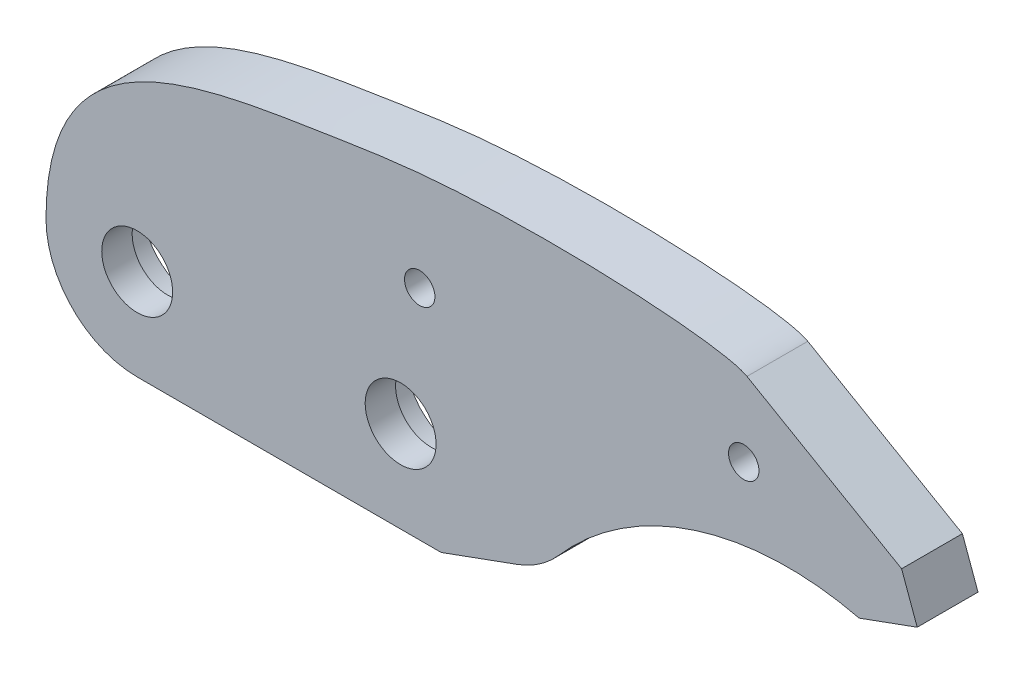
from build123d import *

# Parameters (mm, degrees)
SKETCH1_R           = 3.5
EXTRUSION1_DEPTH    = 6
SKETCH3_R           = 30
EXTRUSION3_DEPTH    = 10
FILLET2_R           = 10
BOSS_EXTRUDE1_DEPTH = 6
SKETCH8_R           = 1.5
CUT_EXTRUDE1_DEPTH  = 14
SKETCH7_R           = 5.5
CUT_EXTRUDE2_DEPTH  = 3


with BuildPart() as part:
    # Sketch1 → Extrusion1 (new body)
    with BuildSketch(Plane.XY):
        with BuildLine():
            Line((0, -9), (30, -9))
            Line((30, -9), (76.984631039, 8.101007166))
            Line((76.984631039, 8.101007166), (75.445540394, 12.32962396))
            Line((75.445540394, 12.32962396), (60.183576084, 21.141123163))
            Line((60.183576084, 21.141123163), (26.826114347, 9))
            Line((26.826114347, 9), (0, 9))
            ThreePointArc((0, 9), (-9, 0), (0, -9))
        make_face()
        with Locations(Location((0, 0, 0), (0, 0, 180))):
            Circle(SKETCH1_R, mode=Mode.SUBTRACT)
        with Locations(Location((26, 0, 0), (0, 0, 180))):
            Circle(SKETCH1_R, mode=Mode.SUBTRACT)
    extrude(amount=EXTRUSION1_DEPTH)

    # Sketch3 → Extrusion3 (cut)
    with BuildSketch(Plane(origin=(0, 0, 0), x_dir=(-1, 0, 0), z_dir=(0, 0, -1))):
        with Locations((-64.222352322, -23.14852672)):
            Circle(SKETCH3_R)
    extrude(amount=-EXTRUSION3_DEPTH, mode=Mode.SUBTRACT)

    # Fillet2
    fillet2_edges = [part.edges().sort_by_distance(p)[0] for p in [
        (40.088809532, -5.327973631, 3),
    ]]
    fillet(fillet2_edges, radius=FILLET2_R)

    # Sketch6 → Boss-Extrude1 (add)
    with BuildSketch(Plane(origin=(0, 0, 0), x_dir=(-1, 0, 0), z_dir=(0, 0, -1))):
        with BuildLine():
            ThreePointArc((0, 9), (6.363961031, 6.363961031), (9, 0))
            add(Edge.make_bspline(
                [(-60.183576084, 21.141123163), (-57.582994943, 22.642569384), (-35.785366448, 23.838648882), (-8.377062942, 19.440019234), (9, 16.91404675), (9, 0)],
                knots=[0, 0, 0, 0, 0.435384133, 0.535384133, 1, 1, 1, 1], degree=3))
            Line((-60.183576084, 21.141123163), (-26.826114347, 9))
            Line((-26.826114347, 9), (0, 9))
        make_face()
    extrude(amount=-BOSS_EXTRUDE1_DEPTH)

    # Sketch8 → Cut-Extrude1 (cut)
    with BuildSketch(Plane(origin=(0, 0, 0), x_dir=(-1, 0, 0), z_dir=(0, 0, -1))):
        with Locations((-59.865613746, 13.663313065)):
            Circle(SKETCH8_R)
        with Locations((-27.885107281, 12.546529171)):
            Circle(SKETCH8_R)
    extrude(amount=-CUT_EXTRUDE1_DEPTH, mode=Mode.SUBTRACT)

    # Sketch7 → Cut-Extrude2 (cut)
    with BuildSketch(Plane(origin=(0, 0, 0), x_dir=(-1, 0, 0), z_dir=(0, 0, -1))):
        Circle(SKETCH7_R)
        with Locations((-26, 0)):
            Circle(SKETCH7_R)
    extrude(amount=-CUT_EXTRUDE2_DEPTH, mode=Mode.SUBTRACT)


solid = part.part
